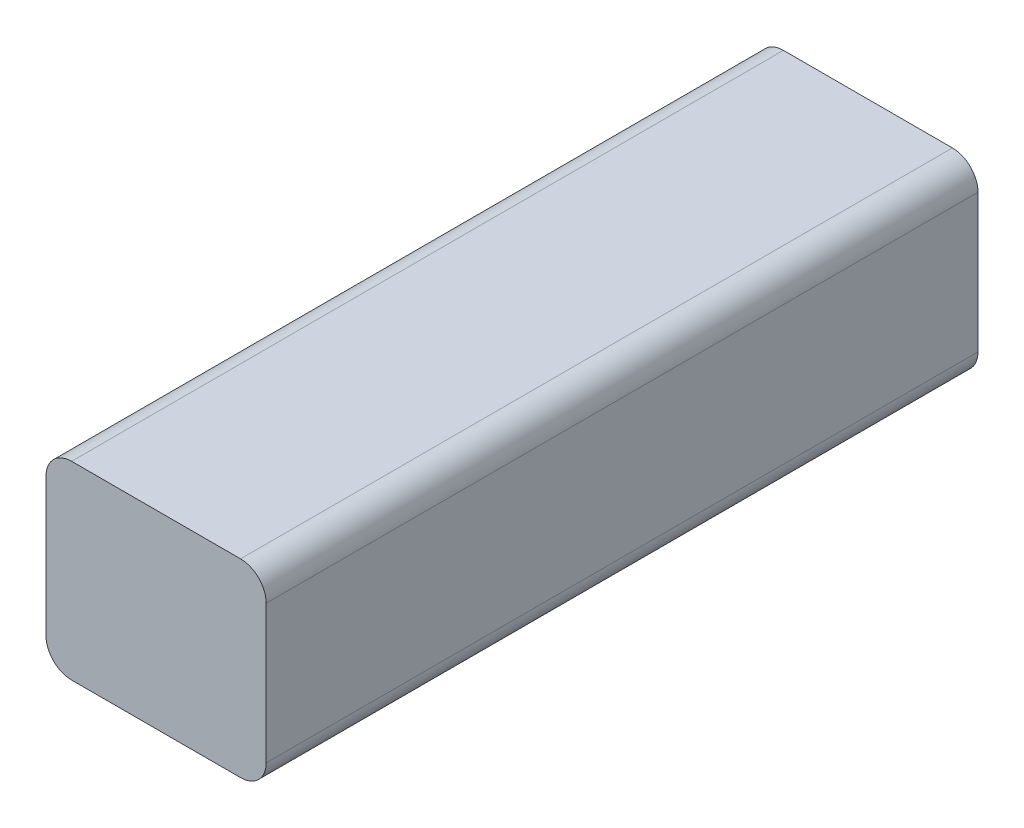
from build123d import *

# Parameters (mm, degrees)
SKETCH_1_W      = 43
SKETCH_1_H      = 37
EXTRUDE_1_DEPTH = 139
FILLET_1_R      = 5


with BuildPart() as part:
    # 草图1 → 凸台-拉伸1 (new body)
    with BuildSketch(Plane.XY):
        Rectangle(SKETCH_1_W, SKETCH_1_H)
    extrude(amount=EXTRUDE_1_DEPTH)

    # 圆角1
    fillet_1_edges = [part.edges().sort_by_distance(p)[0] for p in [
        (-21.5, 18.5, 69.5),
        (21.5, 18.5, 69.5),
        (21.5, -18.5, 69.5),
        (-21.5, -18.5, 69.5),
    ]]
    fillet(fillet_1_edges, radius=FILLET_1_R)


solid = part.part
